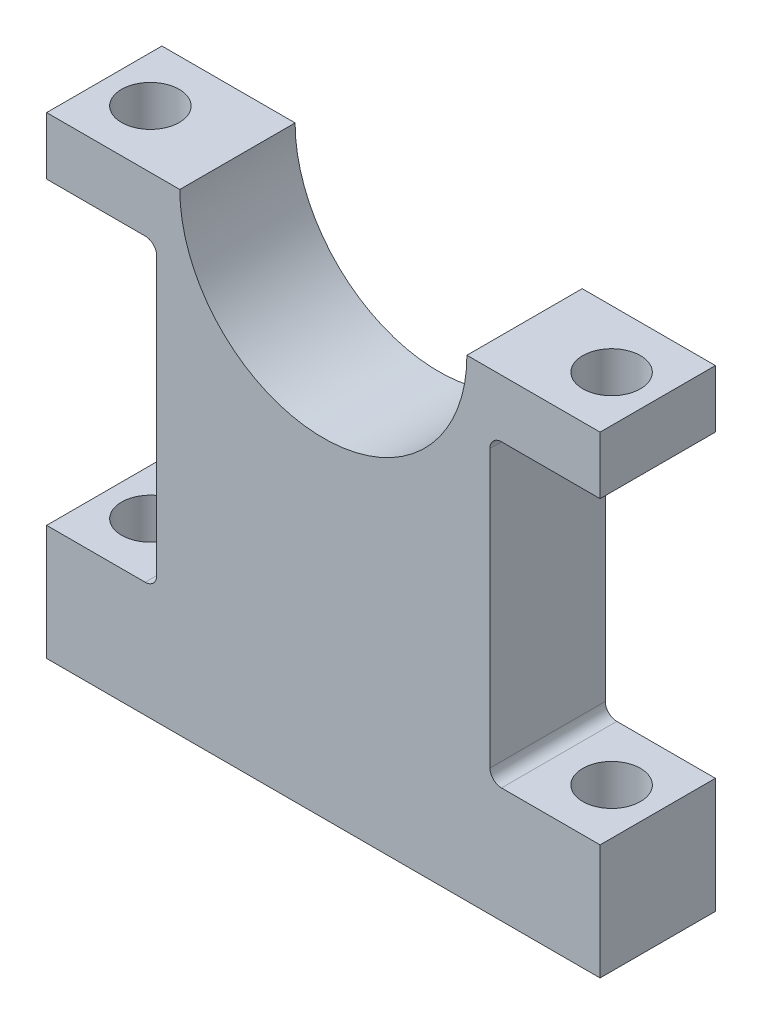
from build123d import *

# Parameters (mm, degrees)
EXTRUDE_1_DEPTH     = 5
SKETCH_3_W          = 48
SKETCH_3_H          = 10
SKETCH_3_R          = 2.5
EXTRUDE_2_DEPTH     = 10
EXTRUDE_START       = -5
SKETCH_4_W          = 48
SKETCH_4_H          = 10
SKETCH_4_R          = 2.5
EXTRUDE_3_DEPTH     = 5
SKETCH_5_W          = 2
SKETCH_5_H          = 26
EXTRUDE_4_DEPTH     = 10
SKETCH_6_R          = 12.45
CUT_EXTRUDE_1_DEPTH = 16
FILLET_2_R          = 1
FILLET_3_R          = 1


with BuildPart() as part:
    # 草图1 → 凸台-拉伸1 (new, symmetric)
    with BuildSketch(Plane.XY):
        with BuildLine():
            Line((12.45, 0), (12.45, -41))
            Line((12.45, -41), (-12.45, -41))
            Line((-12.45, -41), (-12.45, 0))
            ThreePointArc((-12.45, 0), (0, -12.45), (12.45, 0))
        make_face()
    extrude(amount=EXTRUDE_1_DEPTH, both=True)

    # 草图3 → 凸台-拉伸2 (add)
    with BuildSketch(Plane.XZ.offset(41)):
        Rectangle(SKETCH_3_W, SKETCH_3_H)
        with Locations(Location((20, 0, 0), (0, 0, 270))):
            Circle(SKETCH_3_R, mode=Mode.SUBTRACT)
        with Locations(Location((-20, 0, 0), (0, 0, 90))):
            Circle(SKETCH_3_R, mode=Mode.SUBTRACT)
    extrude(amount=-EXTRUDE_2_DEPTH)

    # 草图4 → 凸台-拉伸3 (add)
    with BuildSketch(Plane(origin=(0, 0, 0), x_dir=(1, 0, 0), z_dir=(0, 1, 0)).offset(EXTRUDE_START)):
        Rectangle(SKETCH_4_W, SKETCH_4_H)
        with Locations(Location((-20, 0, 0), (0, 0, 270))):
            Circle(SKETCH_4_R, mode=Mode.SUBTRACT)
        with Locations(Location((20, 0, 0), (0, 0, 90))):
            Circle(SKETCH_4_R, mode=Mode.SUBTRACT)
    extrude(amount=EXTRUDE_3_DEPTH)

    # 草图5 → 凸台-拉伸4 (add)
    with BuildSketch(Plane.XY.offset(5)):
        with Locations((-13.45, -18)):
            Rectangle(SKETCH_5_W, SKETCH_5_H)
        with Locations((13.45, -18)):
            Rectangle(SKETCH_5_W, SKETCH_5_H)
    extrude(amount=-EXTRUDE_4_DEPTH)

    # 草图6 → 切除-拉伸1 (cut)
    with BuildSketch(Plane.XY.offset(5)):
        Circle(SKETCH_6_R)
    extrude(amount=-CUT_EXTRUDE_1_DEPTH, mode=Mode.SUBTRACT)

    # 圆角2
    fillet_2_edges = [part.edges().sort_by_distance(p)[0] for p in [
        (-14.45, -31, 0),
        (14.45, -31, 0),
    ]]
    fillet(fillet_2_edges, radius=FILLET_2_R)

    # 圆角3
    fillet_3_edges = [part.edges().sort_by_distance(p)[0] for p in [
        (-14.45, -5, 0),
        (14.45, -5, 0),
    ]]
    fillet(fillet_3_edges, radius=FILLET_3_R)


solid = part.part
